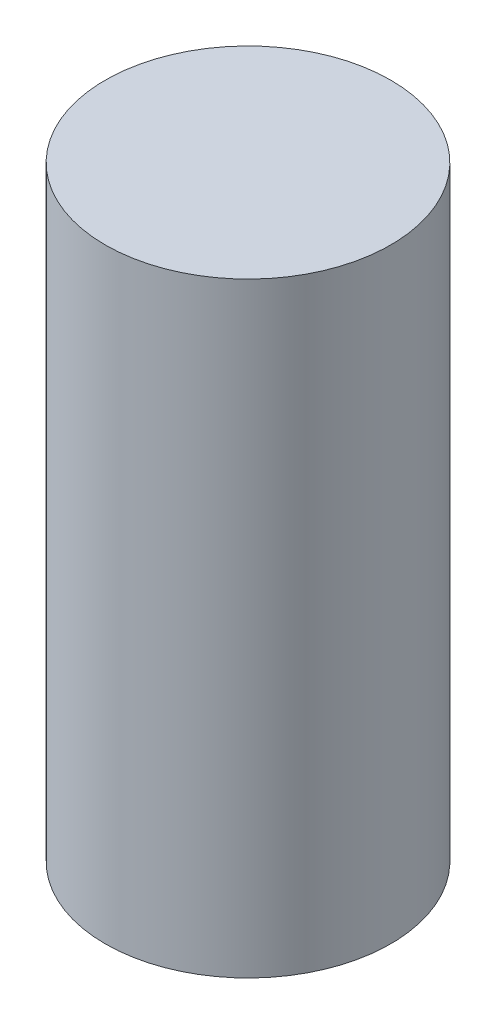
from build123d import *

# Parameters (mm, degrees)
PROFILE_SKETCH_R      = 50
PROFILE_EXTRUDE_DEPTH = 212


with BuildPart() as part:
    # Profile Sketch → Profile Extrude (new body)
    with BuildSketch(Plane(origin=(0, 0, 0), x_dir=(1, 0, 0), z_dir=(0, 1, 0))):
        with Locations(Location((0, 0, 0), (0, 0, 270))):
            Circle(PROFILE_SKETCH_R)
    extrude(amount=-PROFILE_EXTRUDE_DEPTH)


solid = part.part
